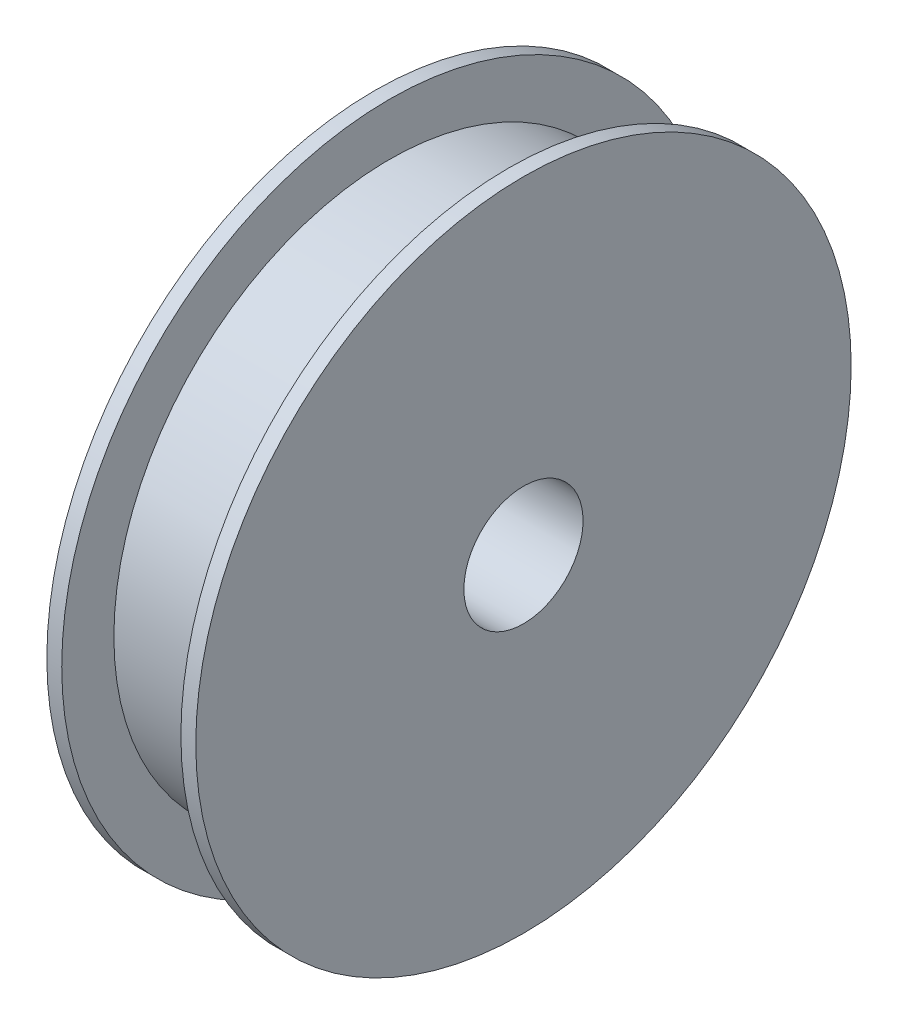
from build123d import *


with BuildPart() as part:
    # Sketch1 → Revolve1 (revolve)
    with BuildSketch(Plane.XY, mode=Mode.PRIVATE) as revolve1_sk:
        Polygon((59.2282167, 22), (58.2282167, 22), (58.2282167, 18.5), (50.2282167, 18.5), (50.2282167, 22), (49.2282167, 22), (49.2282167, 15), (49.2282167, 10), (42.2282167, 10), (42.2282167, 4), (59.2282167, 4), align=None)
    revolve(revolve1_sk.sketch.rotate(Axis((-58.16661515, 0, 0), (1, 0, 0)), 90), axis=Axis((-58.16661515, 0, 0), (1, 0, 0)))


solid = part.part
